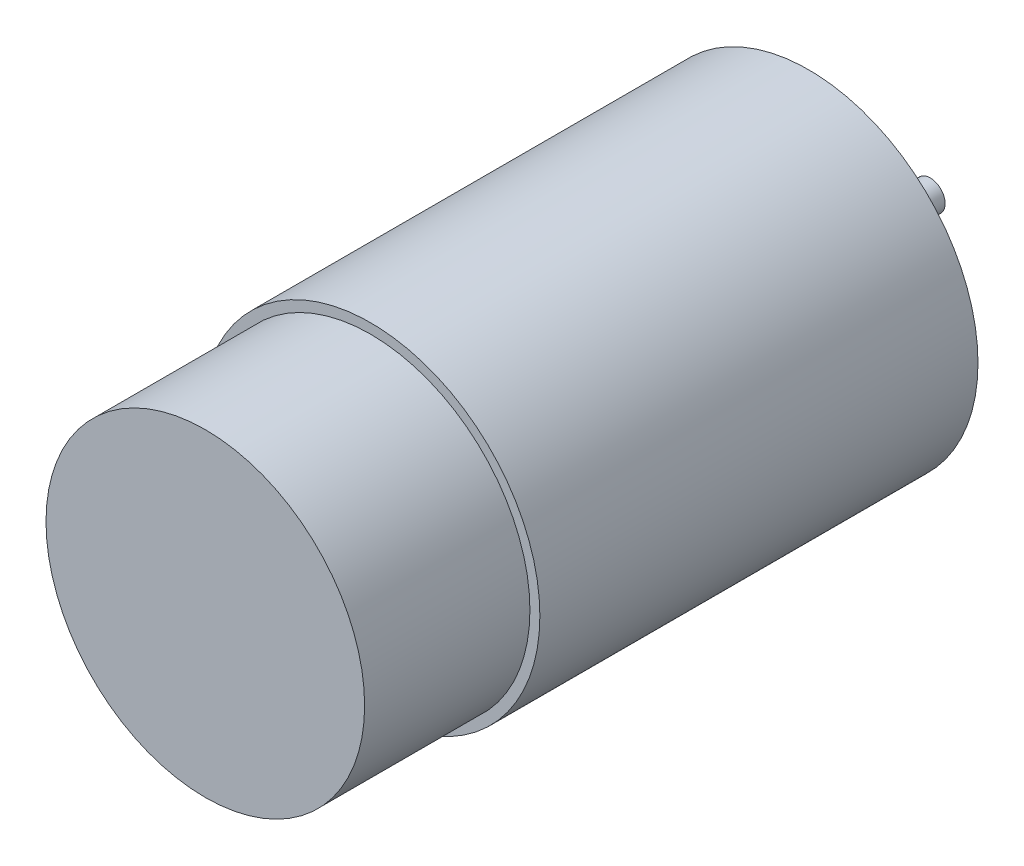
from build123d import *

# Parameters (mm, degrees)
SKETCH_1_R      = 8.5
EXTRUDE_1_DEPTH = 22
SKETCH_2_R      = 8
EXTRUDE_2_DEPTH = 8.3
SKETCH_3_R      = 3
EXTRUDE_3_DEPTH = 1
SKETCH_4_R      = 0.75
EXTRUDE_4_DEPTH = 5.1


with BuildPart() as part:
    # 스케치1 → 돌출1 (new body)
    with BuildSketch(Plane.XY):
        Circle(SKETCH_1_R)
    extrude(amount=EXTRUDE_1_DEPTH)

    # 스케치2 → 돌출2 (add)
    with BuildSketch(Plane.XY.offset(22)):
        with Locations(Location((0, 0, 0), (0, 0, 180))):
            Circle(SKETCH_2_R)
    extrude(amount=EXTRUDE_2_DEPTH)

    # 스케치3 → 돌출3 (add)
    with BuildSketch(Plane(origin=(0, 0, 0), x_dir=(-1, 0, 0), z_dir=(0, 0, -1))):
        with Locations(Location((0, 0, 0), (0, 0, 180))):
            Circle(SKETCH_3_R)
    extrude(amount=EXTRUDE_3_DEPTH)

    # 스케치4 → 돌출4 (add)
    with BuildSketch(Plane(origin=(0, 0, -1), x_dir=(-1, 0, 0), z_dir=(0, 0, -1))):
        Circle(SKETCH_4_R)
    extrude(amount=EXTRUDE_4_DEPTH)


solid = part.part
